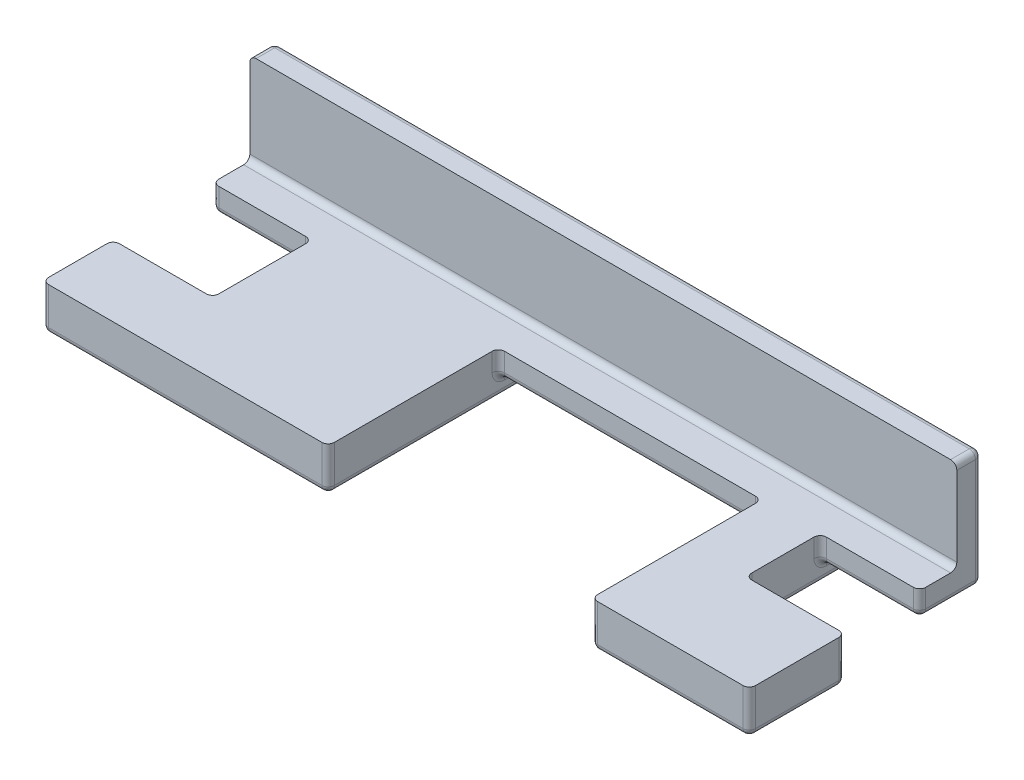
from build123d import *

# Parameters (mm, degrees)
BOSS_EXTRUDE1_START = 9.9
BOSS_EXTRUDE1_DEPTH = 56.9
SKETCH3_W           = 15
SKETCH3_H           = 3
SKETCH3_W_2         = 4.7
SKETCH3_H_2         = 2
BOSS_EXTRUDE2_DEPTH = 3.5
FILLET1_R           = 0.5


with BuildPart() as part:
    # Sketch1 → Boss-Extrude1 (new body)
    with BuildSketch(Plane(origin=(0, 0, 0), x_dir=(0, 0, -1), z_dir=(1, 0, 0)).offset(BOSS_EXTRUDE1_START)):
        Polygon((3.6, -4.5), (3.6, 4.9), (1.6, 4.9), (1.6, -2.5), (-1.4, -2.5), (-1.4, -4.5), align=None)
    extrude(amount=BOSS_EXTRUDE1_DEPTH)

    # Sketch3 → Boss-Extrude2 (add)
    with BuildSketch(Plane(origin=(0, -2.5, 0), x_dir=(1, 0, 0), z_dir=(0, 1, 0))):
        Polygon((32.9, -1.4), (17.9, -1.4), (17.9, -9.4), (9.9, -9.4), (9.9, -15.1), (32.9, -15.1), align=None)
        Polygon((58.8, -1.4), (54.1, -1.4), (54.1, -15.1), (66.8, -15.1), (66.8, -7.4), (58.8, -7.4), align=None)
        with Locations((25.4, 0.1)):
            Rectangle(SKETCH3_W, SKETCH3_H)
        with Locations((56.45, 0.1)):
            Rectangle(SKETCH3_W_2, SKETCH3_H)
        with Locations((25.4, 2.6)):
            Rectangle(SKETCH3_W, SKETCH3_H_2)
        with Locations((56.45, 2.6)):
            Rectangle(SKETCH3_W_2, SKETCH3_H_2)
    extrude(amount=-BOSS_EXTRUDE2_DEPTH)

    # Fillet1
    fillet1_edges = [part.edges().sort_by_distance(p)[0] for p in [
        (9.9, -4.5, -1.1),
        (9.9, -3.5, 1.4),
        (13.9, -4.5, -3.6),
        (13.9, -4.5, 1.4),
        (9.9, 4.9, -2.6),
        (66.8, -4.5, -1.1),
        (9.9, -6, 12.25),
        (62.8, -4.5, 1.4),
        (9.9, -4.25, 15.1),
        (21.4, -6, 15.1),
        (32.9, -4.25, 15.1),
        (32.9, -5.25, -3.6),
        (32.9, -4.5, -1.1),
        (32.9, -3.5, 1.4),
        (32.9, -6, 5.75),
        (17.9, -5.25, -3.6),
        (25.4, -6, -3.6),
        (66.8, -3.5, 1.4),
        (17.9, -3.5, 1.4),
        (17.9, -4.5, -1.1),
        (17.9, -6, 2.9),
        (17.9, -4.25, 9.4),
        (13.9, -6, 9.4),
        (9.9, -4.25, 9.4),
        (38.35, -2.5, -1.6),
        (66.8, 4.9, -2.6),
        (38.35, 4.9, -3.6),
        (66.8, 0.2, -3.6),
        (62.8, -4.5, -3.6),
        (43.5, -4.5, -3.6),
        (43.5, -4.5, 1.4),
        (66.8, -4.25, 7.4),
        (60.45, -6, 15.1),
        (66.8, -4.25, 15.1),
        (54.1, -3.5, 1.4),
        (54.1, -4.5, -1.1),
        (54.1, -6, 5.75),
        (54.1, -4.25, 15.1),
        (54.1, -5.25, -3.6),
        (56.45, -6, -3.6),
        (58.8, -5.25, -3.6),
        (58.8, -4.5, -1.1),
        (58.8, -3.5, 1.4),
        (58.8, -6, 1.9),
        (58.8, -4.25, 7.4),
        (62.8, -6, 7.4),
        (66.8, -6, 11.25),
        (9.9, 0.2, -3.6),
    ]]
    fillet(fillet1_edges, radius=FILLET1_R)


solid = part.part
